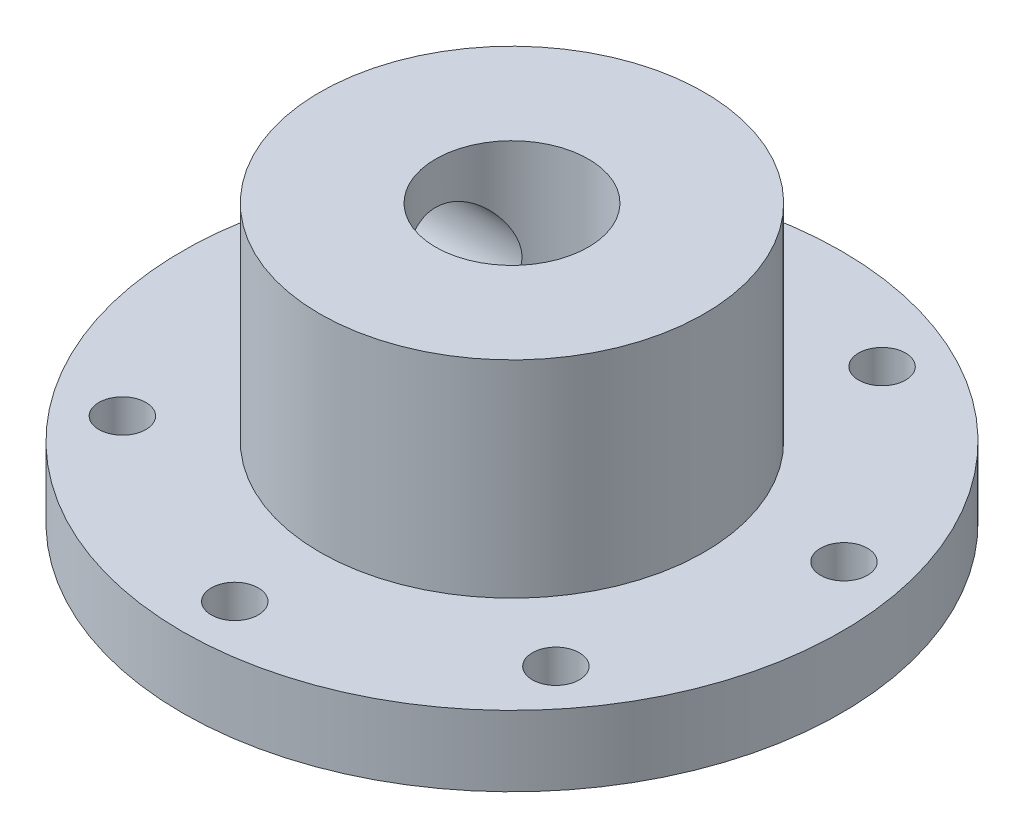
from build123d import *

# Parameters (mm, degrees)
BOSS_EXTRUDE1_DEPTH      = 8.7806917
BOSS_EXTRUDE1_DEPTH_BACK = 3
SKETCH1_R                = 8.175
SKETCH1_R_2              = 3.25
SKETCH1_3_R              = 14.023642089
SKETCH1_3_R_2            = 8.175
BOSS_EXTRUDE2_DEPTH      = 3
SKETCH2_R                = 2.5
CUT_EXTRUDE1_DEPTH       = 15
CUT_EXTRUDE2_DEPTH       = 3.175
CUT_EXTRUDE2_DEPTH_BACK  = 24.067504724
SKETCH3_R                = 1
SKETCH4_R                = 4.175
BOSS_EXTRUDE4_DEPTH      = 5
CUT_EXTRUDE3_DEPTH       = 15
CUT_EXTRUDE3_DEPTH_BACK  = 13
SKETCH1_5_R              = 3.25


with BuildPart() as part:
    # Sketch1 → Boss-Extrude1 (new, two sides: drawn at the far end of the back side and taken through both)
    with BuildSketch(Plane(origin=(0, 0, 0), x_dir=(1, 0, 0), z_dir=(0, 1, 0)).offset(-BOSS_EXTRUDE1_DEPTH_BACK)):
        Circle(SKETCH1_R)
        Circle(SKETCH1_R_2, mode=Mode.SUBTRACT)
    extrude(amount=BOSS_EXTRUDE1_DEPTH + BOSS_EXTRUDE1_DEPTH_BACK)

    # Sketch2 → Cut-Extrude1 (cut)
    with BuildSketch(Plane(origin=(0, 0, 0), x_dir=(0, 0, -1), z_dir=(1, 0, 0))):
        with Locations((0, 4.5)):
            Circle(SKETCH2_R)
    extrude(amount=-CUT_EXTRUDE1_DEPTH, mode=Mode.SUBTRACT)



with BuildPart() as body_2:
    # Sketch1<3> → Boss-Extrude2 (new body)
    with BuildSketch(Plane(origin=(0, 0, 0), x_dir=(1, 0, 0), z_dir=(0, 1, 0))):
        Circle(SKETCH1_3_R)
        Circle(SKETCH1_3_R_2, mode=Mode.SUBTRACT)
    extrude(amount=-BOSS_EXTRUDE2_DEPTH)

    # Sketch3 → Cut-Extrude2 (cut, two sides: drawn at the far end of the back side and taken through both)
    with BuildSketch(Plane.XZ.offset(3).offset(-CUT_EXTRUDE2_DEPTH_BACK)):
        with Locations((0, 11.797323524)):
            Circle(SKETCH3_R)
        with Locations((9.22351894, 7.355510906)):
            Circle(SKETCH3_R)
        with Locations((11.501539993, -2.625151449)):
            Circle(SKETCH3_R)
        with Locations((5.118666842, -10.62902122)):
            Circle(SKETCH3_R)
        with Locations((-5.118666842, -10.62902122)):
            Circle(SKETCH3_R)
        with Locations((-11.501539993, -2.625151449)):
            Circle(SKETCH3_R)
        with Locations((-9.22351894, 7.355510906)):
            Circle(SKETCH3_R)
    extrude(amount=CUT_EXTRUDE2_DEPTH + CUT_EXTRUDE2_DEPTH_BACK, mode=Mode.SUBTRACT)


with BuildPart() as part_1:
    add(part.part)

    add(body_2.part)  # Boss-Extrude4 merges body 2
    # Sketch4 → Boss-Extrude4 (add)
    with BuildSketch(Plane.XZ.offset(3)):
        Circle(SKETCH4_R)
    extrude(amount=BOSS_EXTRUDE4_DEPTH)

    # Sketch1<5> → Cut-Extrude3 (cut, two sides: drawn at the far end of the back side and taken through both)
    with BuildSketch(Plane(origin=(0, 0, 0), x_dir=(1, 0, 0), z_dir=(0, 1, 0)).offset(-CUT_EXTRUDE3_DEPTH_BACK)):
        Circle(SKETCH1_5_R)
    extrude(amount=CUT_EXTRUDE3_DEPTH + CUT_EXTRUDE3_DEPTH_BACK, mode=Mode.SUBTRACT)


solid = part_1.part
